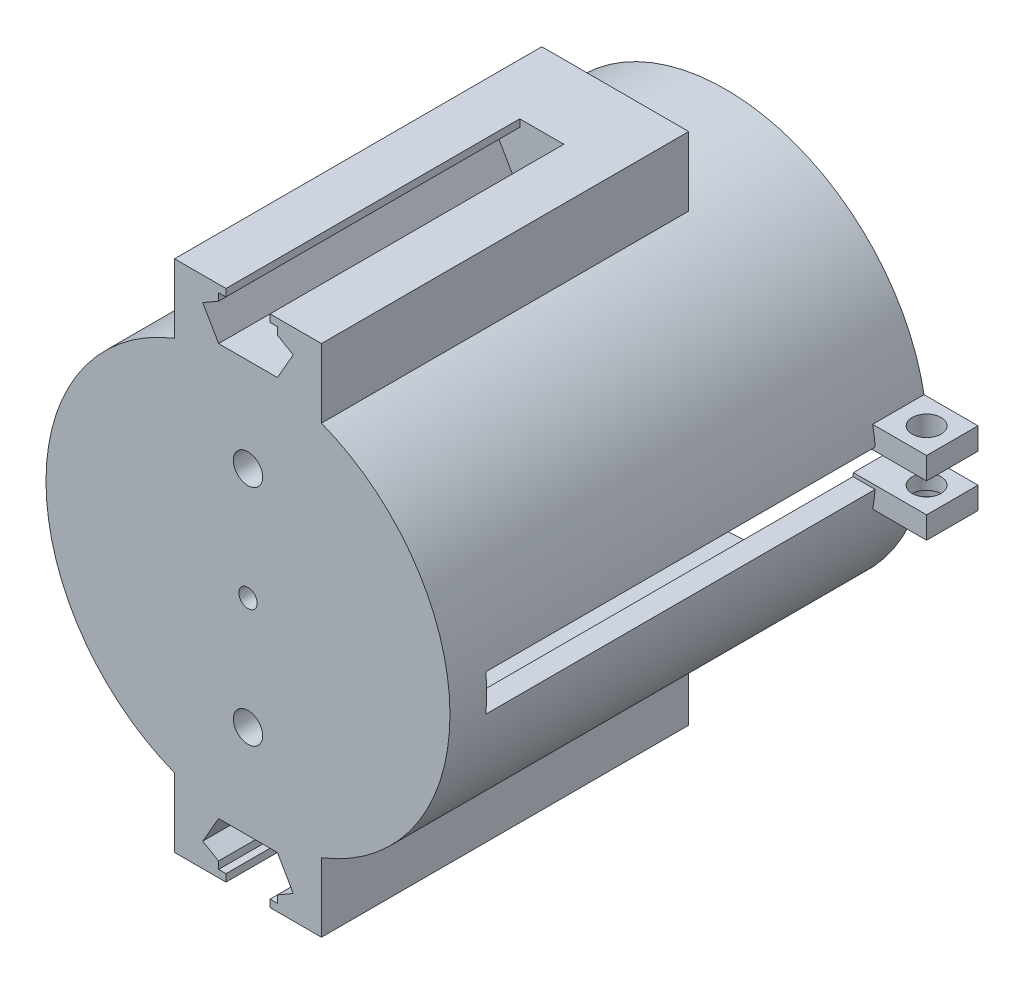
from build123d import *
from build123d.topology import SkipClean

# Parameters (mm, degrees)
SKETCH1_R                       = 34.925
SKETCH1_R_2                     = 15.24
SKETCH1_R_3                     = 2.54
BOSS_EXTRUDE1_DEPTH             = 6.35
BOSS_EXTRUDE2_DEPTH             = 6.35
BOSS_EXTRUDE2_DEPTH_BACK        = 3.81
SKETCH1_2_R                     = 15.24
SKETCH3_R                       = 1.5875
CUT_EXTRUDE2_DEPTH              = 51.425557508
BOSS_EXTRUDE3_START             = 76.2
SKETCH4_R                       = 34.925
SKETCH4_R_2                     = 31.115
BOSS_EXTRUDE3_DEPTH             = 76.2
CUT_EXTRUDE3_START              = 30.48
SKETCH5_W                       = 76.2
SKETCH5_H                       = 6.35
CUT_EXTRUDE3_DEPTH              = 61.327220253
BOSS_EXTRUDE4_START             = 2.54
SKETCH6_W                       = 8.89
SKETCH6_H                       = 8.89
SKETCH6_R                       = 2.5
BOSS_EXTRUDE4_DEPTH             = 3.81
BOSS_EXTRUDE5_START             = -2.54
SKETCH6_2_W                     = 8.89
SKETCH6_2_H                     = 8.89
SKETCH6_2_R                     = 2.5
BOSS_EXTRUDE5_DEPTH             = 3.81
BOSS_EXTRUDE6_REACH             = 111.019
BOSS_EXTRUDE6_END_RADIUS        = 31.115
SKETCH8_W                       = 8.89
SKETCH8_H                       = 3.81
SKETCH9_R                       = 3
SKETCH9_R_2                     = 2.5
CUT_EXTRUDE4_DEPTH              = 1.27
BOSS_EXTRUDE7_REACH             = 116.22
SKETCH12_W                      = 25.4
SKETCH12_H                      = 63.5
BOSS_EXTRUDE7_DIRECTION_2_DEPTH = 6.35
CUT_EXTRUDE5_DEPTH              = 50.8


with BuildPart() as part:
    # Sketch1 → Boss-Extrude1 (new body)
    with BuildSketch(Plane.XY):
        Circle(SKETCH1_R)
        Circle(SKETCH1_R_2, mode=Mode.SUBTRACT)
        with Locations((0, 19.3675)):
            Circle(SKETCH1_R_3, mode=Mode.SUBTRACT)
        with Locations((0, -19.3675)):
            Circle(SKETCH1_R_3, mode=Mode.SUBTRACT)
    extrude(amount=BOSS_EXTRUDE1_DEPTH)

    # Sketch1<2> → Boss-Extrude2 (add, two sides: drawn at the far end of the back side and taken through both)
    with BuildSketch(Plane.XY.offset(-BOSS_EXTRUDE2_DEPTH_BACK)):
        Circle(SKETCH1_2_R)
    extrude(amount=BOSS_EXTRUDE2_DEPTH + BOSS_EXTRUDE2_DEPTH_BACK)

    # Sketch3 → Cut-Extrude2 (cut, through all)
    with BuildSketch(Plane.XY.offset(6.35)):
        Circle(SKETCH3_R)
    extrude(amount=-CUT_EXTRUDE2_DEPTH, mode=Mode.SUBTRACT)

    # Sketch4 → Boss-Extrude3 (add)
    with BuildSketch(Plane(origin=(0, 0, 0), x_dir=(-1, 0, 0), z_dir=(0, 0, -1)).offset(BOSS_EXTRUDE3_START)):
        Circle(SKETCH4_R)
        with Locations(Location((0, 0, 0), (0, 0, 180))):
            Circle(SKETCH4_R_2, mode=Mode.SUBTRACT)
    extrude(amount=-BOSS_EXTRUDE3_DEPTH)

    # Sketch5 → Cut-Extrude3 (cut, through all)
    with SkipClean():  # the faces are left unmerged after this step: merging them gives an invalid solid
        with BuildSketch(Plane(origin=(0, 0, 0), x_dir=(0, 0, -1), z_dir=(1, 0, 0)).offset(CUT_EXTRUDE3_START)):
            with Locations((38.1, 0)):
                Rectangle(SKETCH5_W, SKETCH5_H)
        extrude(amount=CUT_EXTRUDE3_DEPTH, mode=Mode.SUBTRACT)



with BuildPart() as body_2:
    # Sketch6 → Boss-Extrude4 (new body)
    with BuildSketch(Plane(origin=(0, 0, 0), x_dir=(1, 0, 0), z_dir=(0, 1, 0)).offset(BOSS_EXTRUDE4_START)):
        with Locations((39.225382402, 71.755)):
            Rectangle(SKETCH6_W, SKETCH6_H)
        with Locations(Location((39.225382402, 71.755, 0), (0, 0, 90))):
            Circle(SKETCH6_R, mode=Mode.SUBTRACT)
    extrude(amount=BOSS_EXTRUDE4_DEPTH)


with BuildPart() as body_3:
    # Sketch6<2> → Boss-Extrude5 (new body)
    with BuildSketch(Plane(origin=(0, 0, 0), x_dir=(1, 0, 0), z_dir=(0, 1, 0)).offset(BOSS_EXTRUDE5_START)):
        with Locations((39.225382402, 71.755)):
            Rectangle(SKETCH6_2_W, SKETCH6_2_H)
        with Locations(Location((39.225382402, 71.755, 0), (0, 0, 270))):
            Circle(SKETCH6_2_R, mode=Mode.SUBTRACT)
    extrude(amount=-BOSS_EXTRUDE5_DEPTH)


with BuildPart() as part_1:
    with SkipClean():  # the faces are left unmerged after this step: merging them gives an invalid solid
        add(part.part)

        add(body_2.part)  # Boss-Extrude6 merges body 2

        add(body_3.part)  # Boss-Extrude6 merges body 3
        # Boss-Extrude6: up to this cylinder (the profile starts outside it)
        boss_extrude6_end = Plane(origin=(0, 0, -71.755), z_dir=(0, 0, 1)) * Cylinder(BOSS_EXTRUDE6_END_RADIUS, 285.268, mode=Mode.PRIVATE)
        # Sketch8 → Boss-Extrude6 (add, up to the surface)
        with BuildSketch(Plane.ZY.offset(-34.780382402), mode=Mode.PRIVATE) as boss_extrude6_sk1:
            with Locations((-71.755, -4.445)):
                Rectangle(SKETCH8_W, SKETCH8_H)
        boss_extrude6_tool1 = extrude(boss_extrude6_sk1.sketch, amount=BOSS_EXTRUDE6_REACH, mode=Mode.PRIVATE) - boss_extrude6_end
        add(boss_extrude6_tool1.solids().sort_by_distance((34.780382, -4.445, -71.755))[0])
        # Sketch8 → Boss-Extrude6 (add, up to the surface)
        with BuildSketch(Plane.ZY.offset(-34.780382402), mode=Mode.PRIVATE) as boss_extrude6_sk2:
            with Locations((-71.755, 4.445)):
                Rectangle(SKETCH8_W, SKETCH8_H)
        boss_extrude6_tool2 = extrude(boss_extrude6_sk2.sketch, amount=BOSS_EXTRUDE6_REACH, mode=Mode.PRIVATE) - boss_extrude6_end
        add(boss_extrude6_tool2.solids().sort_by_distance((34.780382, 4.445, -71.755))[0])

    # Sketch9 → Cut-Extrude4 (cut)
    with SkipClean():  # the faces are left unmerged after this step: merging them gives an invalid solid
        with BuildSketch(Plane.XZ.offset(6.35)):
            with Locations(Location((39.225382402, -71.755, 0), (0, 0, 270))):
                Circle(SKETCH9_R)
            with Locations(Location((39.225382402, -71.755, 0), (0, 0, 90))):
                Circle(SKETCH9_R_2, mode=Mode.SUBTRACT)
        extrude(amount=-CUT_EXTRUDE4_DEPTH, mode=Mode.SUBTRACT)

    # Sketch12 → Boss-Extrude7 (add, up to next)
    with BuildSketch(Plane(origin=(0, -38.1, 0), x_dir=(1, 0, 0), z_dir=(0, 1, 0)), mode=Mode.PRIVATE) as boss_extrude7_sk1:
        with Locations((0, 25.4)):
            Rectangle(SKETCH12_W, SKETCH12_H)
    boss_extrude7_tool1 = extrude(boss_extrude7_sk1.sketch, amount=BOSS_EXTRUDE7_REACH, mode=Mode.PRIVATE) - part_1.part
    boss_extrude7 = boss_extrude7_tool1.solids().sort_by_distance((0, -38.1, -25.4))[0]
    add(boss_extrude7)

    # Sketch12 → Boss-Extrude7 direction 2 (add)
    with SkipClean():  # the faces are left unmerged after this step: merging them gives an invalid solid
        with BuildSketch(Plane(origin=(0, -38.1, 0), x_dir=(1, 0, 0), z_dir=(0, 1, 0))):
            with Locations((0, 25.4)):
                Rectangle(SKETCH12_W, SKETCH12_H)
        boss_extrude7_direction_2 = extrude(amount=-BOSS_EXTRUDE7_DIRECTION_2_DEPTH)

    # Sketch13 → Cut-Extrude5 (cut)
    with SkipClean():  # the faces are left unmerged after this step: merging them gives an invalid solid
        with BuildSketch(Plane.XY.offset(6.35)):
            Polygon((-3.81, -43.18), (-3.81, -44.45), (3.81, -44.45), (3.81, -43.18), (5.08, -43.18), (5.08, -41.91), (7.829630657, -40.3225), (5.08, -35.56), (-5.08, -35.56), (-7.829630657, -40.3225), (-5.08, -41.91), (-5.08, -43.18), align=None)
        cut_extrude5 = extrude(amount=-CUT_EXTRUDE5_DEPTH, mode=Mode.SUBTRACT)

    # Mirror1: Boss-Extrude7, Boss-Extrude7 direction 2, Cut-Extrude5 across plane
    with SkipClean():  # the faces are left unmerged after this step: merging them gives an invalid solid
        add(boss_extrude7.mirror(Plane.ZX))
        add(boss_extrude7_direction_2.mirror(Plane.ZX))
        add(cut_extrude5.mirror(Plane.ZX), mode=Mode.SUBTRACT)


solid = part_1.part
